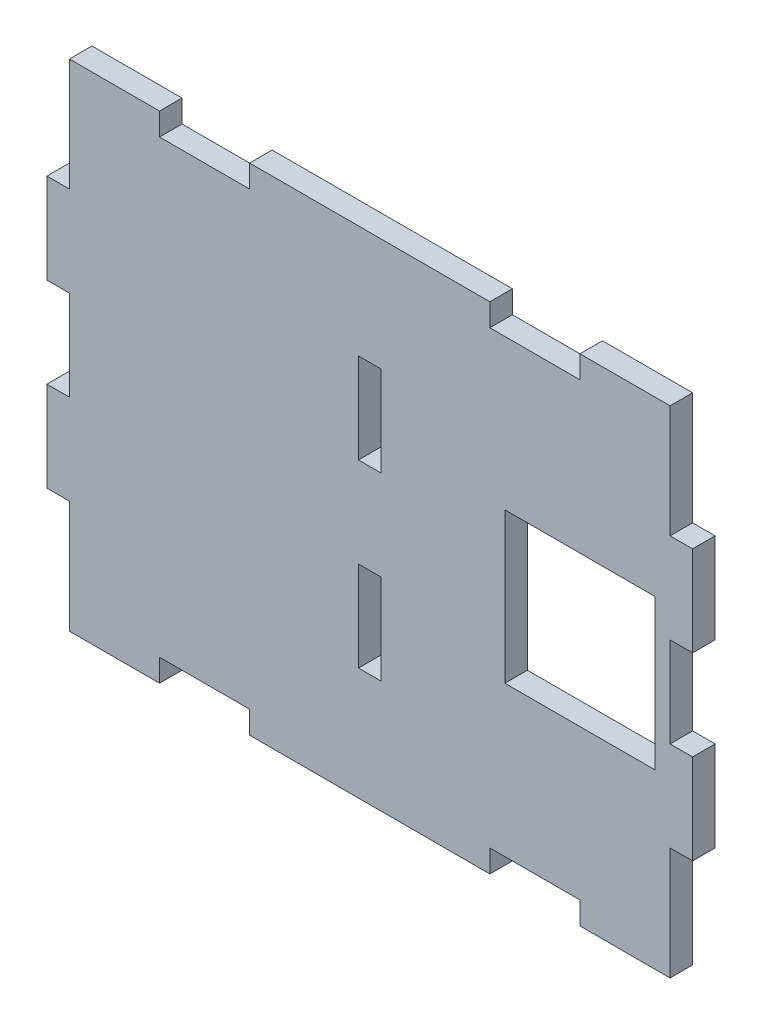
from build123d import *

# Parameters (mm, degrees)
ESBO_O1_W                = 3
ESBO_O1_H                = 12
ESBO_O1_W_2              = 20
ESBO_O1_H_2              = 20
RESSALTO_EXTRUS_O1_DEPTH = 3


with BuildPart() as part:
    # Esboço1 → Ressalto-extrusão1 (new body)
    with BuildSketch(Plane.XY):
        Polygon((-31.216896784, 10.517052385), (-31.216896784, -1.482947615), (-34.216896784, -1.482947615), (-34.216896784, -13.482947615), (-31.216896784, -13.482947615), (-31.216896784, -25.482947615), (-31.216896784, -28.482947615), (-19.216896784, -28.482947615), (-19.216896784, -25.482947615), (-7.216896784, -25.482947615), (-7.216896784, -28.482947615), (4.783103216, -28.482947615), (24.783103216, -28.482947615), (24.783103216, -25.482947615), (36.783103216, -25.482947615), (36.783103216, -28.482947615), (48.783103216, -28.482947615), (48.783103216, -25.482947615), (48.783103216, -13.482947615), (51.783103216, -13.482947615), (51.783103216, -1.482947615), (48.783103216, -1.482947615), (48.783103216, 10.517052385), (51.783103216, 10.517052385), (51.783103216, 22.517052385), (48.783103216, 22.517052385), (48.783103216, 34.517052385), (48.783103216, 37.517052385), (36.783103216, 37.517052385), (36.783103216, 34.517052385), (24.783103216, 34.517052385), (24.783103216, 37.517052385), (-1.216896784, 37.517052385), (-7.216896784, 37.517052385), (-7.216896784, 34.517052385), (-19.216896784, 34.517052385), (-19.216896784, 37.517052385), (-31.216896784, 37.517052385), (-31.216896784, 34.517052385), (-31.216896784, 22.517052385), (-34.216896784, 22.517052385), (-34.216896784, 10.517052385), align=None)
        with Locations((8.783103216, 16.517052385)):
            Rectangle(ESBO_O1_W, ESBO_O1_H, mode=Mode.SUBTRACT)
        with Locations((8.783103216, -7.482947615)):
            Rectangle(ESBO_O1_W, ESBO_O1_H, mode=Mode.SUBTRACT)
        with Locations((36.783103216, 4.517052385)):
            Rectangle(ESBO_O1_W_2, ESBO_O1_H_2, mode=Mode.SUBTRACT)
    extrude(amount=RESSALTO_EXTRUS_O1_DEPTH)


solid = part.part
